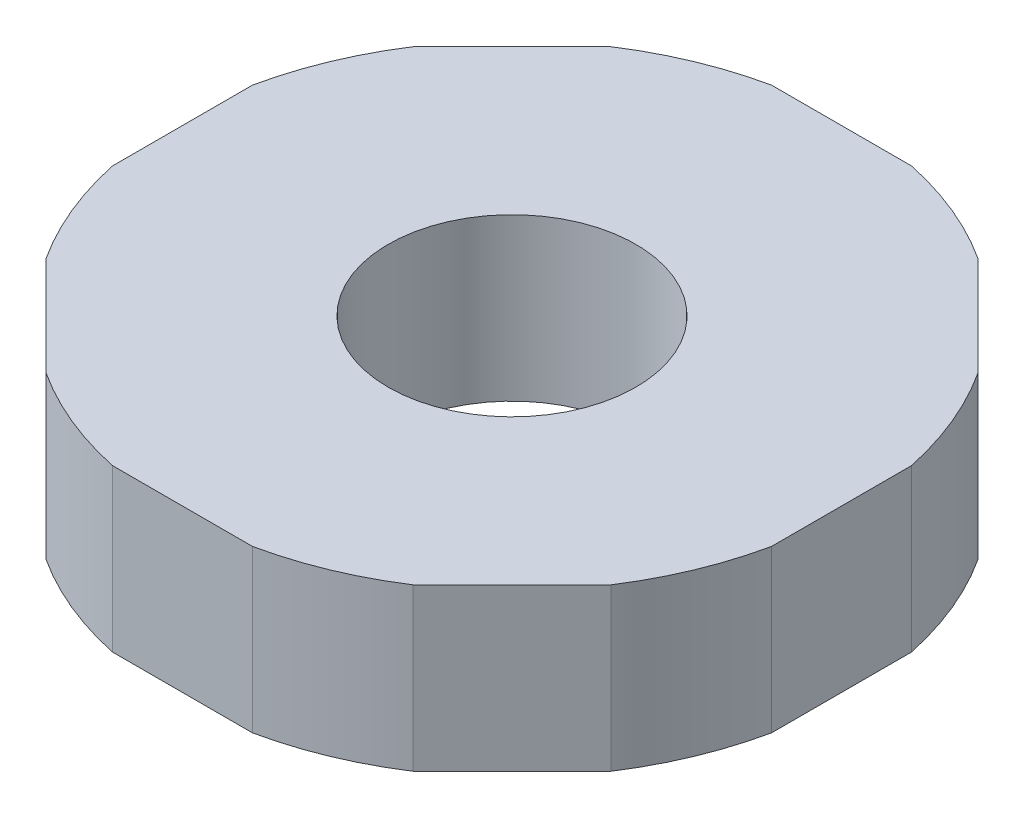
from build123d import *

# Parameters (mm, degrees)
SKETCH1_R           = 2.3
BOSS_EXTRUDE1_DEPTH = 3


with BuildPart() as part:
    # Sketch1 → Boss-Extrude1 (new body)
    with BuildSketch(Plane(origin=(0, 0, 0), x_dir=(1, 0, 0), z_dir=(0, 1, 0))):
        with BuildLine():
            Line((3.409188309, -5.24766594), (5.24766594, -3.409188309))
            ThreePointArc((5.24766594, -3.409188309), (5.781490388, -2.39477173), (6.121320344, -1.3))
            Line((6.121320344, -1.3), (6.121320344, 1.3))
            ThreePointArc((6.121320344, 1.3), (5.781490388, 2.39477173), (5.24766594, 3.409188309))
            Line((5.24766594, 3.409188309), (3.409188309, 5.24766594))
            ThreePointArc((3.409188309, 5.24766594), (2.39477173, 5.781490388), (1.3, 6.121320344))
            Line((1.3, 6.121320344), (-1.3, 6.121320344))
            ThreePointArc((-1.3, 6.121320344), (-2.39477173, 5.781490388), (-3.409188309, 5.24766594))
            Line((-3.409188309, 5.24766594), (-5.24766594, 3.409188309))
            ThreePointArc((-5.24766594, 3.409188309), (-5.781490388, 2.39477173), (-6.121320344, 1.3))
            Line((-6.121320344, 1.3), (-6.121320344, -1.3))
            ThreePointArc((-6.121320344, -1.3), (-5.781490388, -2.39477173), (-5.24766594, -3.409188309))
            Line((-5.24766594, -3.409188309), (-3.409188309, -5.24766594))
            ThreePointArc((-3.409188309, -5.24766594), (-2.39477173, -5.781490388), (-1.3, -6.121320344))
            Line((-1.3, -6.121320344), (1.3, -6.121320344))
            ThreePointArc((1.3, -6.121320344), (2.39477173, -5.781490388), (3.409188309, -5.24766594))
        make_face()
        with Locations(Location((0, 0, 0), (0, 0, 270))):
            Circle(SKETCH1_R, mode=Mode.SUBTRACT)
    extrude(amount=-BOSS_EXTRUDE1_DEPTH)


solid = part.part
